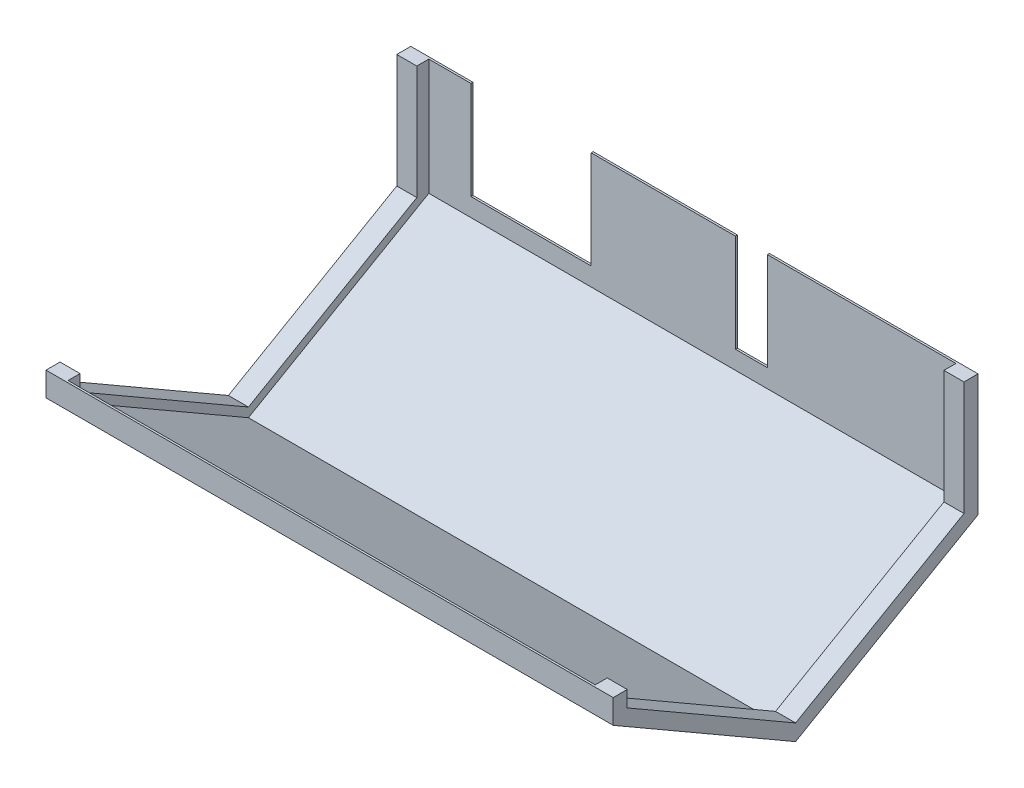
from build123d import *

# Parameters (mm, degrees)
EXTRUDE_1_DEPTH     = 13150
EXTRUDE_2_DEPTH     = 500
EXTRUDE_START       = -13150
EXTRUDE_3_DEPTH     = 500
SKETCH_4_W          = 800
SKETCH_4_H          = 2702.478260032
SKETCH_4_W_2        = 3000
SKETCH_4_H_2        = 2678.418031008
CUT_EXTRUDE_2_DEPTH = 460
SKETCH_7_W          = 15709.854083563
SKETCH_7_H          = 3227.507192375
CUT_EXTRUDE_4_DEPTH = 670


with BuildPart() as part:
    # Эскиз2 → Бобышка-Вытянуть1 (new body)
    with BuildSketch(Plane(origin=(0, 0, 0), x_dir=(0, 0, -1), z_dir=(1, 0, 0))):
        Polygon((4500, -2921.28129211), (9050, -294.337567297), (9050, 2750), (9000, 2750), (9000, -150), (4500, -2748.076211353), (0, -150), (0, 2750), (-50, 2750), (-50, -294.337567297), align=None)
    extrude(amount=-EXTRUDE_1_DEPTH)

    # Эскиз5 → Бобышка-Вытянуть2 (add)
    with BuildSketch(Plane(origin=(0, 0, 0), x_dir=(0, 0, -1), z_dir=(1, 0, 0))):
        Polygon((-50, 2750), (-50, -294.337567297), (4500, -2921.28129211), (9050, -294.337567297), (9050, 2750), (8700, 2750), (8700, -92.264973081), (4500, -2517.136103677), (300, -92.264973081), (300, 2750), align=None)
    extrude(amount=EXTRUDE_2_DEPTH)

    # Эскиз5<2> → Бобышка-Вытянуть3 (add)
    with BuildSketch(Plane(origin=(0, 0, 0), x_dir=(0, 0, -1), z_dir=(1, 0, 0)).offset(EXTRUDE_START)):
        Polygon((-50, 2750), (-50, -294.337567297), (4500, -2921.28129211), (9050, -294.337567297), (9050, 2750), (8700, 2750), (8700, -92.264973081), (4500, -2517.136103677), (300, -92.264973081), (300, 2750), align=None)
    extrude(amount=-EXTRUDE_3_DEPTH)

    # Эскиз4 → Вырез-Вытянуть2 (cut)
    with BuildSketch(Plane(origin=(0, 0, -9050), x_dir=(-1, 0, 0), z_dir=(0, 0, -1))):
        with Locations((5100, 1656.901562719)):
            Rectangle(SKETCH_4_W, SKETCH_4_H)
        with Locations((10600, 1644.871448207)):
            Rectangle(SKETCH_4_W_2, SKETCH_4_H_2)
    extrude(amount=-CUT_EXTRUDE_2_DEPTH, mode=Mode.SUBTRACT)

    # Эскиз7 → Вырез-Вытянуть4 (cut)
    with BuildSketch(Plane.XY.offset(50)):
        with Locations((-6585.237035545, 1919.416028891)):
            Rectangle(SKETCH_7_W, SKETCH_7_H)
    extrude(amount=-CUT_EXTRUDE_4_DEPTH, mode=Mode.SUBTRACT)


solid = part.part
